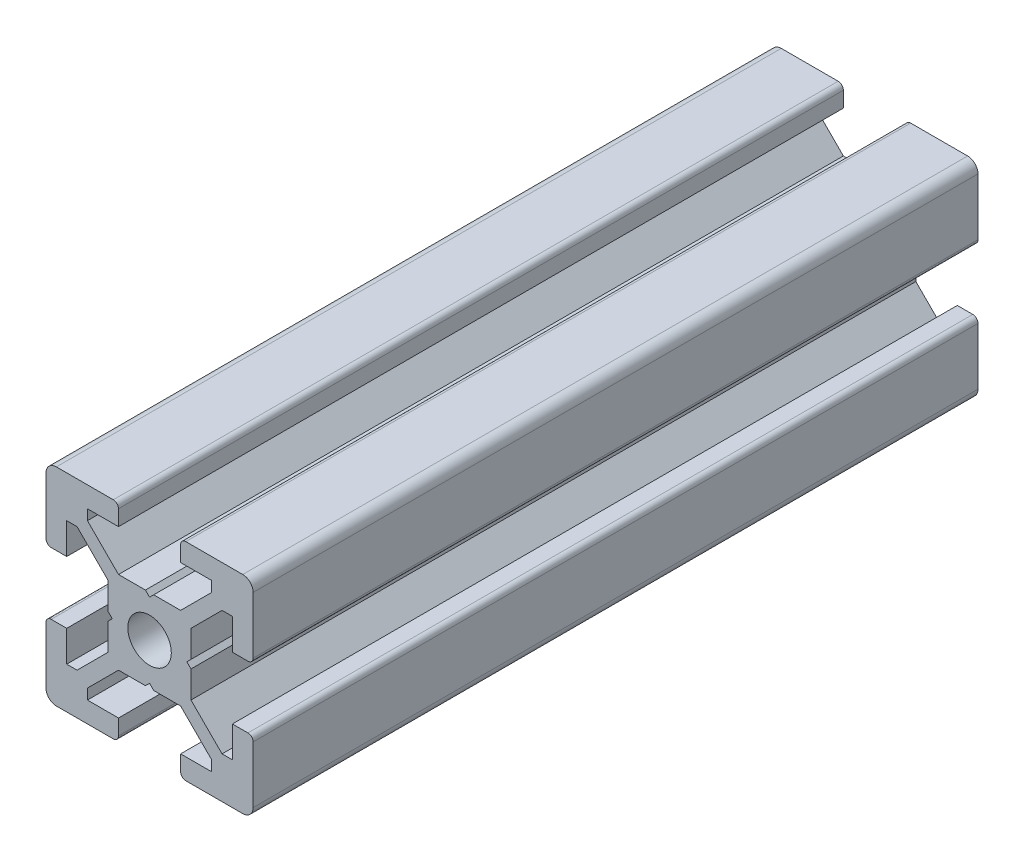
from build123d import *

# Parameters (mm, degrees)
SCHIZZO1_R                   = 2.1
ESTRUSIONE_ESTRUSIONE1_DEPTH = 70


with BuildPart() as part:
    # Schizzo1 → Estrusione-Estrusione1 (new body)
    with BuildSketch(Plane.XY):
        with BuildLine():
            Line((-3.6, 0), (-4, 0.4))
            Line((-4, 0.4), (-4, 3))
            Line((-4, 3), (-7, 6))
            Line((-7, 6), (-8, 6))
            Line((-8, 6), (-8, 3))
            Line((-8, 3), (-9.5, 3))
            ThreePointArc((-9.5, 3), (-9.853553391, 3.146446609), (-10, 3.5))
            Line((-10, 3.5), (-10, 9))
            ThreePointArc((-10, 9), (-9.707106781, 9.707106781), (-9, 10))
            Line((-9, 10), (-3.5, 10))
            ThreePointArc((-3.5, 10), (-3.146446609, 9.853553391), (-3, 9.5))
            Line((-3, 9.5), (-3, 8))
            Line((-3, 8), (-6, 8))
            Line((-6, 8), (-6, 7))
            Line((-6, 7), (-3, 4))
            Line((-3, 4), (-0.4, 4))
            Line((-0.4, 4), (0, 3.6))
            Line((0, 3.6), (0.4, 4))
            Line((0.4, 4), (3, 4))
            Line((3, 4), (6, 7))
            Line((6, 7), (6, 8))
            Line((6, 8), (3, 8))
            Line((3, 8), (3, 9.5))
            ThreePointArc((3, 9.5), (3.146446609, 9.853553391), (3.5, 10))
            Line((3.5, 10), (9, 10))
            ThreePointArc((9, 10), (9.707106781, 9.707106781), (10, 9))
            Line((10, 9), (10, 3.5))
            ThreePointArc((10, 3.5), (9.853553391, 3.146446609), (9.5, 3))
            Line((9.5, 3), (8, 3))
            Line((8, 3), (8, 6))
            Line((8, 6), (7, 6))
            Line((7, 6), (4, 3))
            Line((4, 3), (4, 0.4))
            Line((4, 0.4), (3.6, 0))
            Line((3.6, 0), (4, -0.4))
            Line((4, -0.4), (4, -3))
            Line((4, -3), (7, -6))
            Line((7, -6), (8, -6))
            Line((8, -6), (8, -3))
            Line((8, -3), (9.5, -3))
            ThreePointArc((9.5, -3), (9.853553391, -3.146446609), (10, -3.5))
            Line((10, -3.5), (10, -9))
            ThreePointArc((10, -9), (9.707106781, -9.707106781), (9, -10))
            Line((9, -10), (3.5, -10))
            ThreePointArc((3.5, -10), (3.146446609, -9.853553391), (3, -9.5))
            Line((3, -9.5), (3, -8))
            Line((3, -8), (6, -8))
            Line((6, -8), (6, -7))
            Line((6, -7), (3, -4))
            Line((3, -4), (0.4, -4))
            Line((0.4, -4), (0, -3.6))
            Line((0, -3.6), (-0.4, -4))
            Line((-0.4, -4), (-3, -4))
            Line((-3, -4), (-6, -7))
            Line((-6, -7), (-6, -8))
            Line((-6, -8), (-3, -8))
            Line((-3, -8), (-3, -9.5))
            ThreePointArc((-3, -9.5), (-3.146446609, -9.853553391), (-3.5, -10))
            Line((-3.5, -10), (-9, -10))
            ThreePointArc((-9, -10), (-9.707106781, -9.707106781), (-10, -9))
            Line((-10, -9), (-10, -3.5))
            ThreePointArc((-10, -3.5), (-9.853553391, -3.146446609), (-9.5, -3))
            Line((-9.5, -3), (-8, -3))
            Line((-8, -3), (-8, -6))
            Line((-8, -6), (-7, -6))
            Line((-7, -6), (-4, -3))
            Line((-4, -3), (-4, -0.4))
            Line((-4, -0.4), (-3.6, 0))
        make_face()
        Circle(SCHIZZO1_R, mode=Mode.SUBTRACT)
    extrude(amount=ESTRUSIONE_ESTRUSIONE1_DEPTH)


solid = part.part
